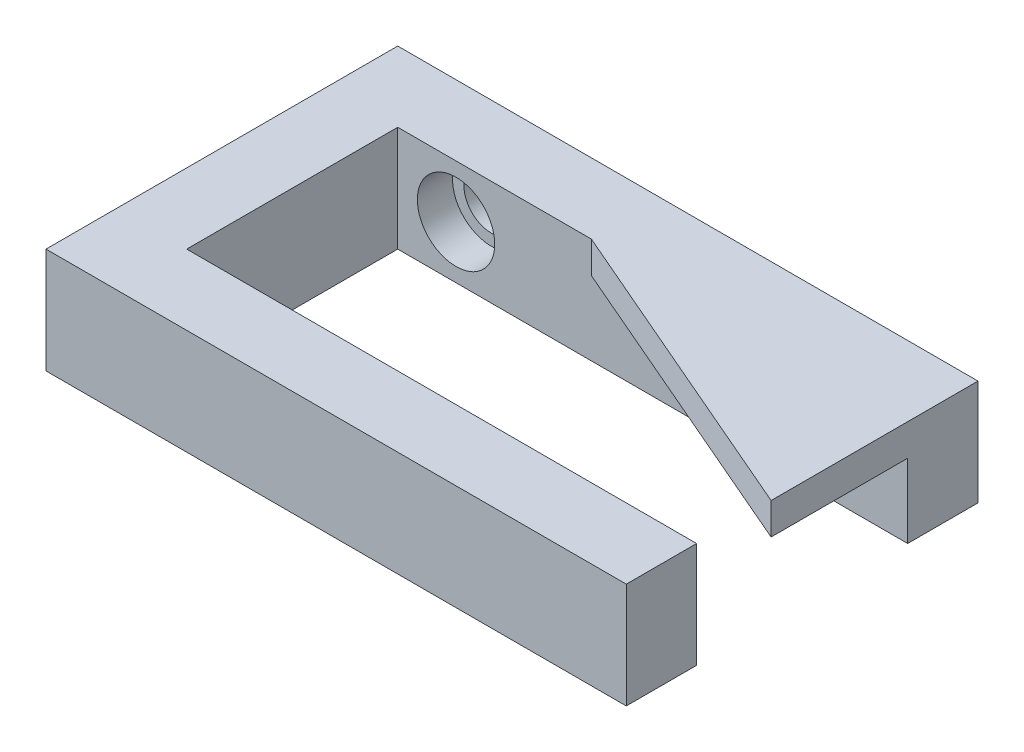
from build123d import *

# Parameters (mm, degrees)
IZIM1_W                          = 280
IZIM1_H                          = 100
IZIM1_W_2                        = 240
IZIM1_H_2                        = 60
Y_KSEKLIK_EKSTR_ZYON1_DEPTH      = 30
IZIM4_R                          = 11
KES_EKSTR_ZYON1_DEPTH            = 40
IZIM5_W                          = 65
IZIM5_H                          = 15
KES_EKSTR_ZYON2_DEPTH            = 119
KES_EKSTR_ZYON3_DEPTH            = 24.5
Y_KSEKLIK_EKSTR_ZYON4_DEPTH      = 8
Y_KSEKLIK_EKSTR_ZYON4_DEPTH_BACK = 1
IZIM13_R                         = 7.75
KES_EKSTR_ZYON4_DEPTH            = 18
IZIM14_W                         = 134.069696652
IZIM14_H                         = 104.641272027
KES_EKSTR_ZYON7_DEPTH            = 136


with BuildPart() as part:
    # Çizim1 → Yükseklik-Ekstrüzyon1 (new body)
    with BuildSketch(Plane(origin=(0, 0, 0), x_dir=(1, 0, 0), z_dir=(0, 1, 0))):
        with Locations((120, 30)):
            Rectangle(IZIM1_W, IZIM1_H)
        with Locations((120, 30)):
            Rectangle(IZIM1_W_2, IZIM1_H_2, mode=Mode.SUBTRACT)
    extrude(amount=Y_KSEKLIK_EKSTR_ZYON1_DEPTH)

    # Çizim4 → Kes-Ekstrüzyon1 (cut, symmetric)
    with BuildSketch(Plane.XY.offset(-30)):
        with Locations((228.036930768, 15)):
            Circle(IZIM4_R)
        with Locations((16.579541137, 15)):
            Circle(IZIM4_R)
        with Locations((95.469880506, 15)):
            Circle(IZIM4_R)
    extrude(amount=KES_EKSTR_ZYON1_DEPTH, both=True, mode=Mode.SUBTRACT)

    # Çizim5 → Kes-Ekstrüzyon2 (cut)
    with BuildSketch(Plane.XY.offset(20)):
        with Locations((177.478221097, 22.5)):
            Rectangle(IZIM5_W, IZIM5_H)
    extrude(amount=-KES_EKSTR_ZYON2_DEPTH, mode=Mode.SUBTRACT)

    # Çizim6 → Kes-Ekstrüzyon3 (cut, symmetric)
    with BuildSketch(Plane.XY.offset(-30)):
        Polygon((260, 31.552276972), (234.133246527, 31.552276972), (234.359911555, 20.467639669), (260, 4.801073138), align=None)
    extrude(amount=KES_EKSTR_ZYON3_DEPTH, both=True, mode=Mode.SUBTRACT)

    # Çizim10 → Yükseklik-Ekstrüzyon4 (add, two sides: drawn at the far end of the back side and taken through both)
    with BuildSketch(Plane(origin=(0, 22, 0), x_dir=(1, 0, 0), z_dir=(0, 1, 0)).offset(-Y_KSEKLIK_EKSTR_ZYON4_DEPTH_BACK)):
        Polygon((55.057032044, 60), (144.978221097, 21.175943648), (144.978221097, 60), align=None)
    extrude(amount=Y_KSEKLIK_EKSTR_ZYON4_DEPTH + Y_KSEKLIK_EKSTR_ZYON4_DEPTH_BACK)

    # Çizim13 → Kes-Ekstrüzyon4 (cut)
    with BuildSketch(Plane(origin=(0, 0, -80), x_dir=(-1, 0, 0), z_dir=(0, 0, -1))):
        with Locations((-16.579541137, 15)):
            Circle(IZIM13_R)
    extrude(amount=-KES_EKSTR_ZYON4_DEPTH, mode=Mode.SUBTRACT)

    # Çizim14 → Kes-Ekstrüzyon7 (cut)
    with BuildSketch(Plane(origin=(0, 30, 0), x_dir=(1, 0, 0), z_dir=(0, 1, 0))):
        with Locations((212.013069423, 32.320636013)):
            Rectangle(IZIM14_W, IZIM14_H)
    extrude(amount=-KES_EKSTR_ZYON7_DEPTH, mode=Mode.SUBTRACT)


solid = part.part
